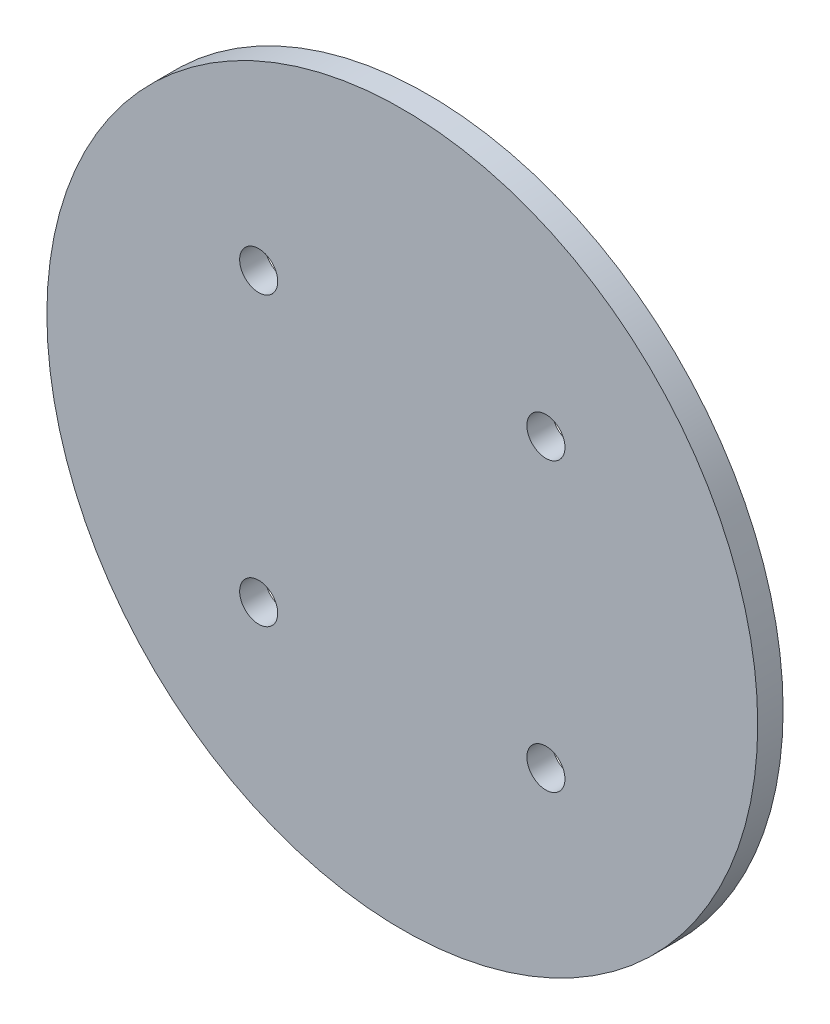
from build123d import *

# Parameters (mm, degrees)
SKETCH1_R               = 88.9
BOSS_EXTRUDE1_DEPTH     = 6.35
CUT_EXTRUDE1_DEPTH      = 126.88384527
CUT_EXTRUDE1_DEPTH_BACK = 126.88384527
SKETCH2_R               = 4.7625


with BuildPart() as part:
    # Sketch1 → Boss-Extrude1 (new body)
    with BuildSketch(Plane.XY):
        Circle(SKETCH1_R)
    extrude(amount=BOSS_EXTRUDE1_DEPTH)

    # Sketch2 → Cut-Extrude1 (cut, two sides: drawn at the far end of the back side and taken through both)
    with BuildSketch(Plane.XY.offset(6.35).offset(-CUT_EXTRUDE1_DEPTH_BACK)):
        with Locations((-35.921024484, 35.921024484)):
            Circle(SKETCH2_R)
        with Locations((35.921024484, 35.921024484)):
            Circle(SKETCH2_R)
        with Locations((35.921024484, -35.921024484)):
            Circle(SKETCH2_R)
        with Locations((-35.921024484, -35.921024484)):
            Circle(SKETCH2_R)
    extrude(amount=CUT_EXTRUDE1_DEPTH + CUT_EXTRUDE1_DEPTH_BACK, mode=Mode.SUBTRACT)


solid = part.part
